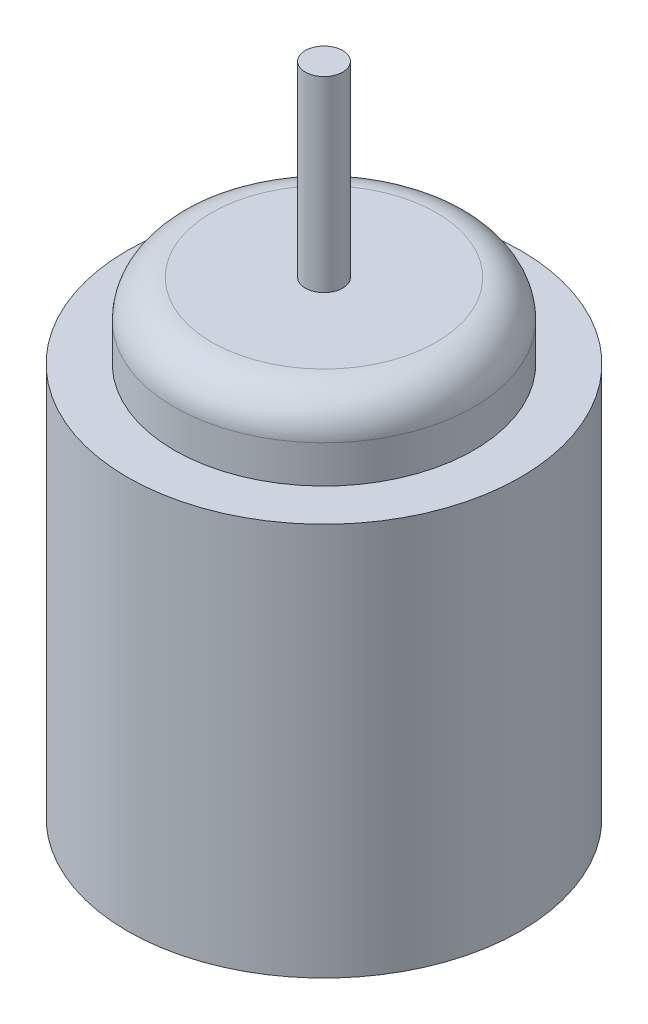
from build123d import *

# Parameters (mm, degrees)
SKETCH_1_R      = 10.5
EXTRUDE_1_DEPTH = 21
SKETCH_2_R      = 8
EXTRUDE_2_DEPTH = 4
FILLET_1_R      = 2
SKETCH_3_R      = 1
EXTRUDE_3_DEPTH = 10


with BuildPart() as part:
    # 草圖1 → 填料-伸長1 (new body)
    with BuildSketch(Plane(origin=(0, 0, 0), x_dir=(1, 0, 0), z_dir=(0, 1, 0))):
        with Locations(Location((0, 0, 0), (0, 0, 90))):
            Circle(SKETCH_1_R)
    extrude(amount=EXTRUDE_1_DEPTH)

    # 草圖2 → 填料-伸長2 (add)
    with BuildSketch(Plane(origin=(0, 21, 0), x_dir=(1, 0, 0), z_dir=(0, 1, 0))):
        with Locations(Location((0, 0, 0), (0, 0, 270))):
            Circle(SKETCH_2_R)
    extrude(amount=EXTRUDE_2_DEPTH)

    # 圓角1
    fillet_1_edges = [part.edges().sort_by_distance(p)[0] for p in [
        (0, 25, -8),
    ]]
    fillet(fillet_1_edges, radius=FILLET_1_R)

    # 草圖3 → 填料-伸長3 (add)
    with BuildSketch(Plane(origin=(0, 25, 0), x_dir=(1, 0, 0), z_dir=(0, 1, 0))):
        with Locations(Location((0, 0, 0), (0, 0, 270))):
            Circle(SKETCH_3_R)
    extrude(amount=EXTRUDE_3_DEPTH)


solid = part.part
